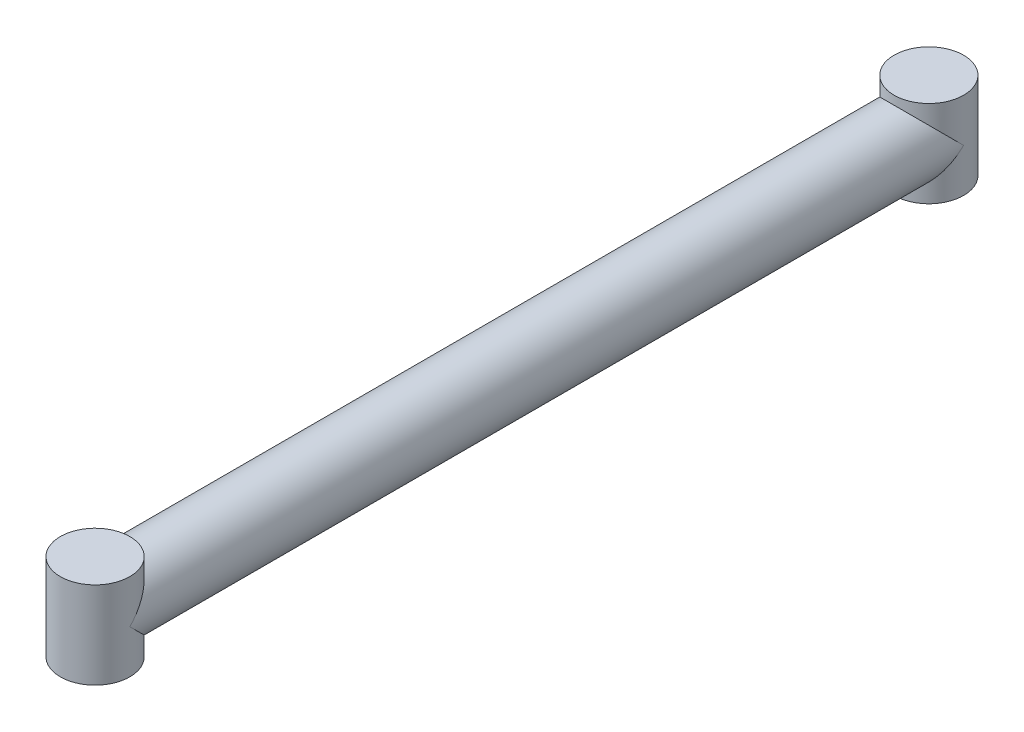
from build123d import *

# Parameters (mm, degrees)
CROQUIS1_R                   = 10
SALIENTE_EXTRUIR1_DEPTH      = 240
SALIENTE_EXTRUIR2_DEPTH      = 12.5
SALIENTE_EXTRUIR2_DEPTH_BACK = 12.5
CROQUIS2_R                   = 10


with BuildPart() as part:
    # Croquis1 → Saliente-Extruir1 (new body)
    with BuildSketch(Plane.XY):
        Circle(CROQUIS1_R)
    extrude(amount=SALIENTE_EXTRUIR1_DEPTH)

    # Croquis2 → Saliente-Extruir2 (add, two sides: drawn at the far end of the back side and taken through both)
    with BuildSketch(Plane(origin=(0, 0, 0), x_dir=(1, 0, 0), z_dir=(0, 1, 0)).offset(-SALIENTE_EXTRUIR2_DEPTH_BACK)):
        Circle(CROQUIS2_R)
        with Locations((0, -240)):
            Circle(CROQUIS2_R)
    extrude(amount=SALIENTE_EXTRUIR2_DEPTH + SALIENTE_EXTRUIR2_DEPTH_BACK)


solid = part.part
